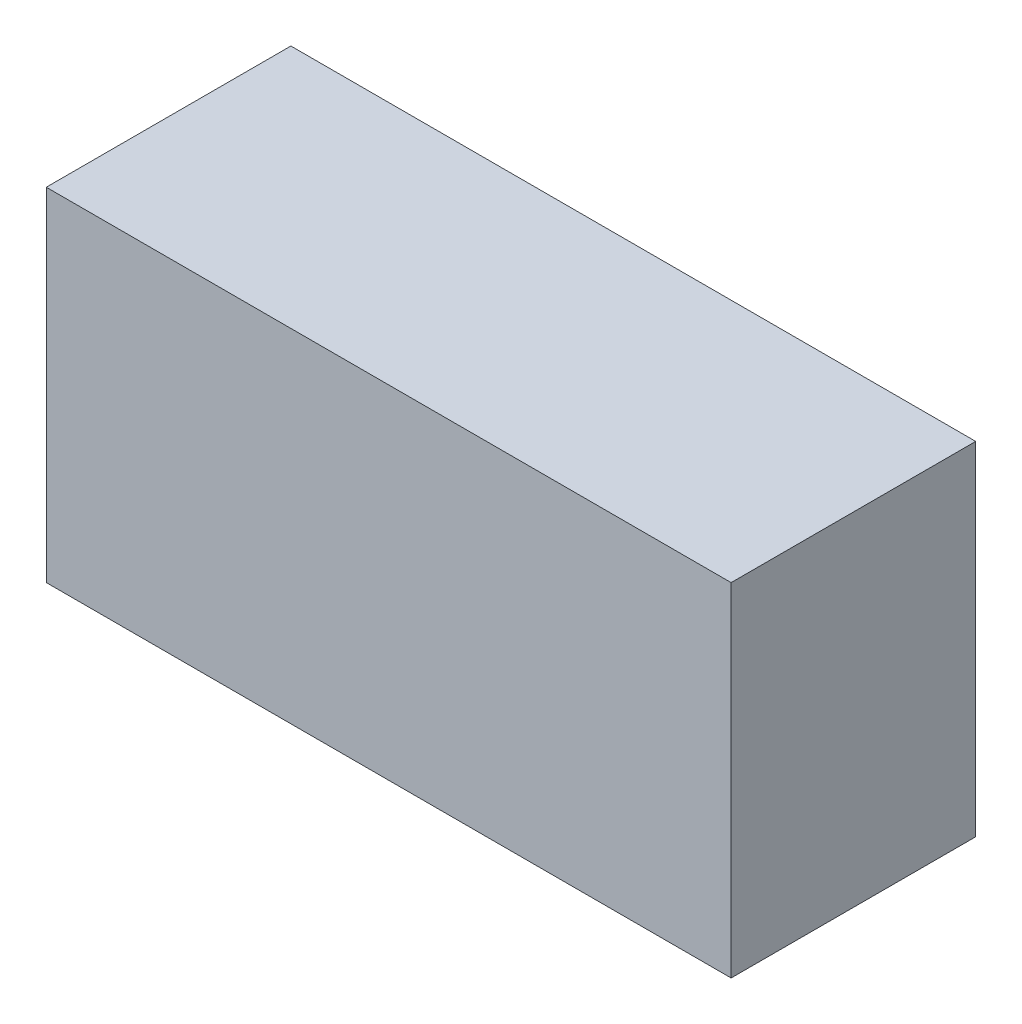
from build123d import *

# Parameters (mm, degrees)
SKETCH1_W           = 70
SKETCH1_H           = 35
BOSS_EXTRUDE1_DEPTH = 25


with BuildPart() as part:
    # Sketch1 → Boss-Extrude1 (new body)
    with BuildSketch(Plane.XY):
        with Locations((35, -17.5)):
            Rectangle(SKETCH1_W, SKETCH1_H)
    extrude(amount=BOSS_EXTRUDE1_DEPTH)


solid = part.part
